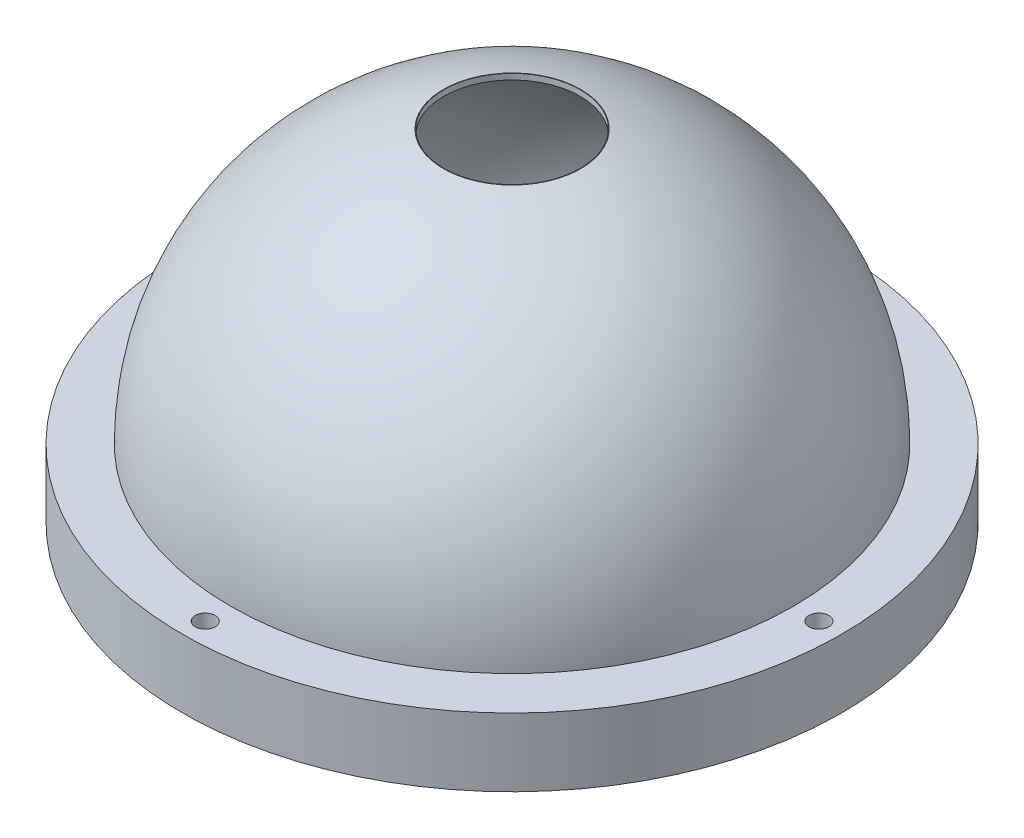
from build123d import *

# Parameters (mm, degrees)
CUT_EXTRUDE1_REACH  = 86.879
SKETCH2_R           = 12
SKETCH3_R           = 58
SKETCH3_R_2         = 48.5
BOSS_EXTRUDE1_DEPTH = 12
CUT_EXTRUDE2_REACH  = 103.627
SKETCH4_R           = 1.75


with BuildPart() as part:
    # Sketch1 → Revolve-Thin1 (revolve)
    with BuildSketch(Plane.XY, mode=Mode.PRIVATE) as revolve_thin1_sk:
        with BuildLine():
            Line((0, 47), (11.968709204, 47))
            ThreePointArc((11.968709204, 47), (38.293161246, 29.763800191), (48.5, 0))
            Line((48.5, 0), (49.5, 0))
            ThreePointArc((49.5, 0), (39.044030516, 30.427186546), (12.093386622, 48))
            Line((12.093386622, 48), (0, 48))
            Line((0, 48), (0, 47))
        make_face()
    revolve(revolve_thin1_sk.sketch.rotate(Axis((0, -100.538171033, 0), (0, 1, 0)), 90), axis=Axis((0, -100.538171033, 0), (0, 1, 0)))

    # Sketch2 → Cut-Extrude1 (cut, up to next)
    with BuildSketch(Plane(origin=(0, 48, 0), x_dir=(1, 0, 0), z_dir=(0, 1, 0)), mode=Mode.PRIVATE) as cut_extrude1_sk1:
        with Locations(Location((0, 0, 0), (0, 0, 270))):
            Circle(SKETCH2_R)
    cut_extrude1_tool1 = extrude(cut_extrude1_sk1.sketch, amount=-CUT_EXTRUDE1_REACH, mode=Mode.PRIVATE) & part.part
    add(cut_extrude1_tool1.solids().sort_by_distance((0, 48, 0))[0], mode=Mode.SUBTRACT)

    # Sketch3 → Boss-Extrude1 (add)
    with BuildSketch(Plane.XZ):
        with Locations(Location((0, 0, 0), (0, 0, 270))):
            Circle(SKETCH3_R)
        with Locations(Location((0, 0, 0), (0, 0, 270))):
            Circle(SKETCH3_R_2, mode=Mode.SUBTRACT)
    extrude(amount=BOSS_EXTRUDE1_DEPTH)

    # Sketch4 → Cut-Extrude2 (cut, up to next)
    with BuildSketch(Plane.XZ.offset(12), mode=Mode.PRIVATE) as cut_extrude2_sk1:
        with Locations(Location((0, 54, 0), (0, 0, 270))):
            Circle(SKETCH4_R)
    cut_extrude2_tool1 = extrude(cut_extrude2_sk1.sketch, amount=-CUT_EXTRUDE2_REACH, mode=Mode.PRIVATE) & part.part
    # Sketch4 → Cut-Extrude2 (cut, up to next)
    with BuildSketch(Plane.XZ.offset(12), mode=Mode.PRIVATE) as cut_extrude2_sk2:
        with Locations(Location((54, 0, 0), (0, 0, 270))):
            Circle(SKETCH4_R)
    cut_extrude2_tool2 = extrude(cut_extrude2_sk2.sketch, amount=-CUT_EXTRUDE2_REACH, mode=Mode.PRIVATE) & part.part
    # Sketch4 → Cut-Extrude2 (cut, up to next)
    with BuildSketch(Plane.XZ.offset(12), mode=Mode.PRIVATE) as cut_extrude2_sk3:
        with Locations(Location((-54, 0, 0), (0, 0, 270))):
            Circle(SKETCH4_R)
    cut_extrude2_tool3 = extrude(cut_extrude2_sk3.sketch, amount=-CUT_EXTRUDE2_REACH, mode=Mode.PRIVATE) & part.part
    # Sketch4 → Cut-Extrude2 (cut, up to next)
    with BuildSketch(Plane.XZ.offset(12), mode=Mode.PRIVATE) as cut_extrude2_sk4:
        with Locations(Location((0, -54, 0), (0, 0, 270))):
            Circle(SKETCH4_R)
    cut_extrude2_tool4 = extrude(cut_extrude2_sk4.sketch, amount=-CUT_EXTRUDE2_REACH, mode=Mode.PRIVATE) & part.part
    add(cut_extrude2_tool1.solids().sort_by_distance((0, -12, 54))[0], mode=Mode.SUBTRACT)
    add(cut_extrude2_tool2.solids().sort_by_distance((54, -12, 0))[0], mode=Mode.SUBTRACT)
    add(cut_extrude2_tool3.solids().sort_by_distance((-54, -12, 0))[0], mode=Mode.SUBTRACT)
    add(cut_extrude2_tool4.solids().sort_by_distance((0, -12, -54))[0], mode=Mode.SUBTRACT)


solid = part.part
